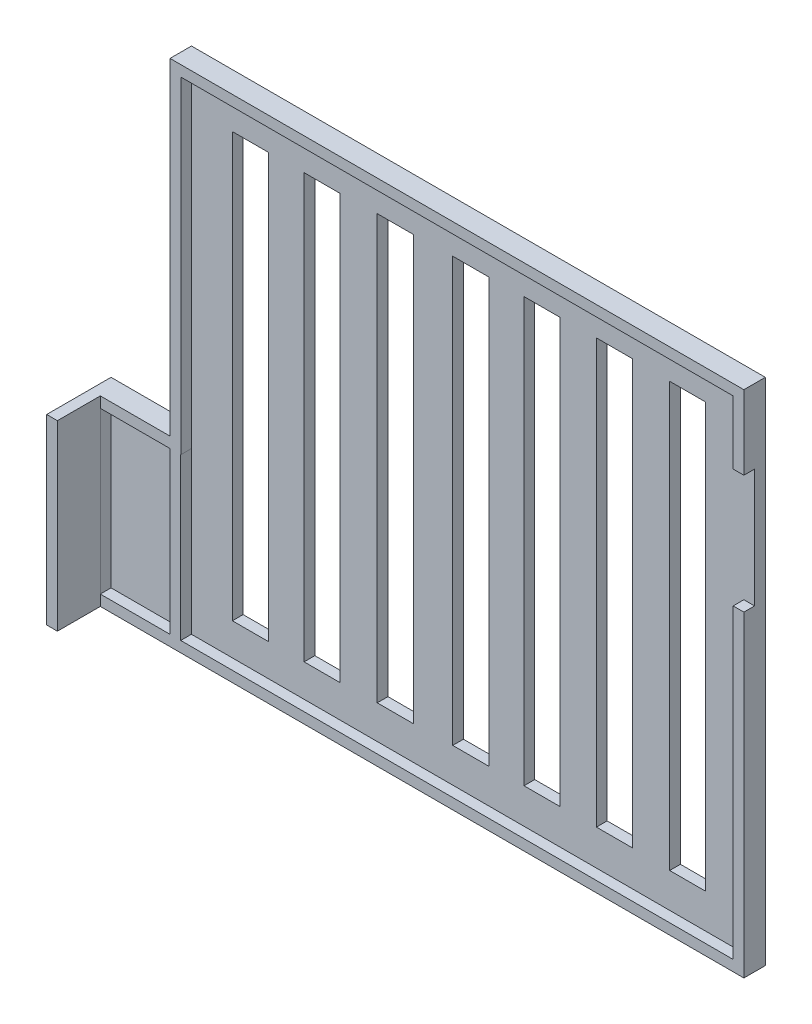
from build123d import *

# Parameters (mm, degrees)
SKETCH1_W           = 107
SKETCH1_H           = 95
SKETCH1_W_2         = 6.717391304
SKETCH1_H_2         = 79
SKETCH1_W_3         = 6.717391305
SKETCH1_W_4         = 15
SKETCH1_H_3         = 34
BOSS_EXTRUDE1_DEPTH = 4
CUT_EXTRUDE1_DEPTH  = 2
SKETCH5_W           = 2.000809174
SKETCH5_H           = 34
BOSS_EXTRUDE3_DEPTH = 8
SKETCH6_W           = 2
SKETCH6_H           = 22.102752069
CUT_EXTRUDE2_DEPTH  = 2
SKETCH7_W           = 1.989121342
SKETCH7_H           = 2
BOSS_EXTRUDE4_DEPTH = 30


with BuildPart() as part:
    # Sketch1 → Boss-Extrude1 (new body)
    # profile 1 of 2: a face of its own
    with BuildSketch(Plane.XY):
        with Locations((-0.188618926, -8.710358056)):
            Rectangle(SKETCH1_W, SKETCH1_H)
        with Locations((-40.699488491, -8.710358056)):
            Rectangle(SKETCH1_W_2, SKETCH1_H_2, mode=Mode.SUBTRACT)
        with Locations((-27.328779255, -8.658557904)):
            Rectangle(SKETCH1_W_2, SKETCH1_H_2, mode=Mode.SUBTRACT)
        with Locations((-13.692855398, -8.457629635)):
            Rectangle(SKETCH1_W_2, SKETCH1_H_2, mode=Mode.SUBTRACT)
        with Locations((0.382489646, -8.294414238)):
            Rectangle(SKETCH1_W_3, SKETCH1_H_2, mode=Mode.SUBTRACT)
        with Locations((13.672826098, -8.166203861)):
            Rectangle(SKETCH1_W_2, SKETCH1_H_2, mode=Mode.SUBTRACT)
        with Locations((27.177523355, -8.09026595)):
            Rectangle(SKETCH1_W_2, SKETCH1_H_2, mode=Mode.SUBTRACT)
        with Locations((40.840153453, -8.266624041)):
            Rectangle(SKETCH1_W_2, SKETCH1_H_2, mode=Mode.SUBTRACT)
    # profile 2 of 2: a face of its own
    with BuildSketch(Plane.XY):
        with Locations((-61.188618926, -39.210358056)):
            Rectangle(SKETCH1_W_4, SKETCH1_H_3)
    extrude(amount=BOSS_EXTRUDE1_DEPTH)

    # Sketch3 → Cut-Extrude1 (cut)
    with BuildSketch(Plane.XY.offset(4)):
        Polygon((51.311381074, -54.210358056), (51.311381074, 36.789641944), (-51.688618926, 36.789641944), (-51.688618926, -24.210358056), (-66.688618926, -24.210358056), (-66.688618926, -54.210358056), align=None)
    extrude(amount=-CUT_EXTRUDE1_DEPTH, mode=Mode.SUBTRACT)

    # Sketch5 → Boss-Extrude3 (add)
    with BuildSketch(Plane.XY.offset(4)):
        with Locations((-67.688214339, -39.210358056)):
            Rectangle(SKETCH5_W, SKETCH5_H)
    extrude(amount=BOSS_EXTRUDE3_DEPTH)

    # Sketch6 → Cut-Extrude2 (cut)
    with BuildSketch(Plane.XY.offset(4)):
        with Locations((52.311381074, 13.925496341)):
            Rectangle(SKETCH6_W, SKETCH6_H)
    extrude(amount=-CUT_EXTRUDE2_DEPTH, mode=Mode.SUBTRACT)

    # Sketch7 → Boss-Extrude4 (add)
    with BuildSketch(Plane.XZ.offset(24.210358056)):
        with Locations((-52.693548431, 3)):
            Rectangle(SKETCH7_W, SKETCH7_H)
    extrude(amount=BOSS_EXTRUDE4_DEPTH)


solid = part.part
